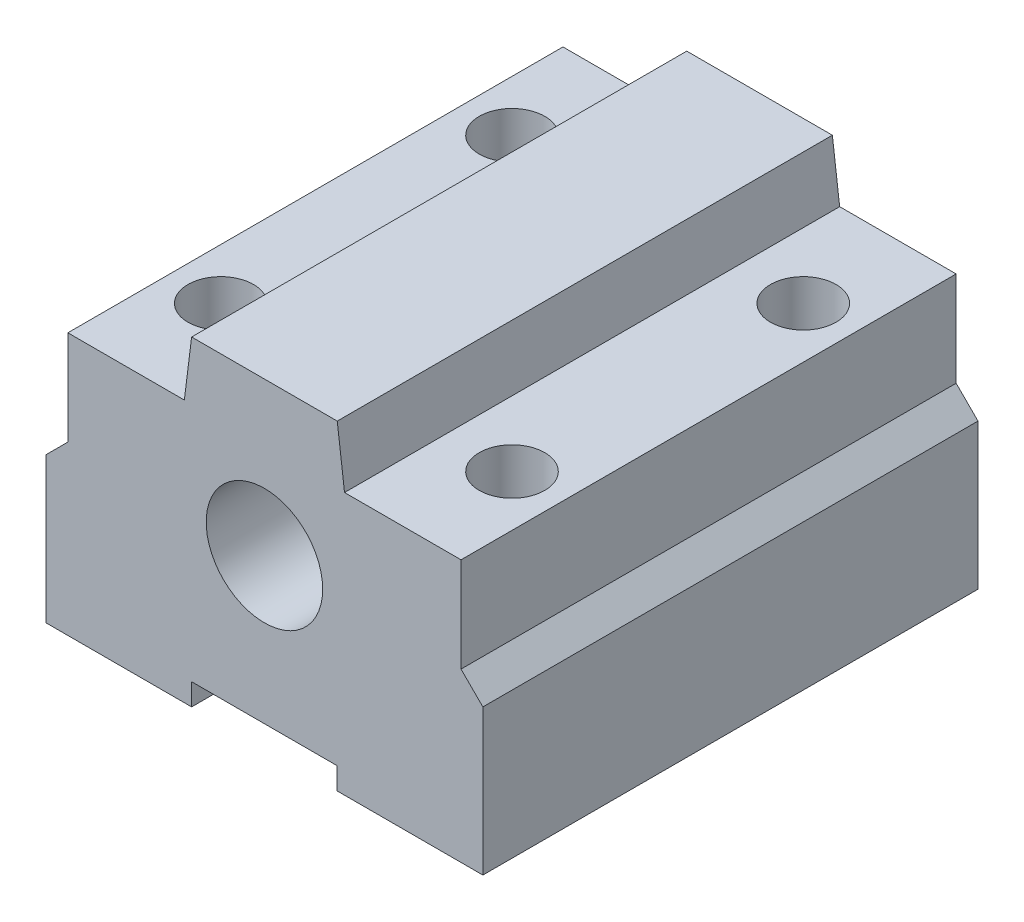
from build123d import *

# Parameters (mm, degrees)
SKETCH1_R           = 4
BOSS_EXTRUDE1_DEPTH = 34
SKETCH2_R           = 2.25
CUT_EXTRUDE1_DEPTH  = 42.291645644


with BuildPart() as part:
    # Sketch1 → Boss-Extrude1 (new body)
    with BuildSketch(Plane.XY):
        Polygon((5, -10), (-5, -10), (-5, -11.5), (-15, -11.5), (-15, -1.5), (-13.5, 0), (-13.5, 6.5), (-5.5, 6.5), (-5, 10.5), (5, 10.5), (5.5, 6.5), (13.5, 6.5), (13.5, 0), (15, -1.5), (15, -11.5), (5, -11.5), align=None)
        Circle(SKETCH1_R, mode=Mode.SUBTRACT)
    extrude(amount=BOSS_EXTRUDE1_DEPTH)

    # Sketch2 → Cut-Extrude1 (cut, through all)
    with BuildSketch(Plane(origin=(0, 6.5, 0), x_dir=(1, 0, 0), z_dir=(0, 1, 0))):
        with Locations(Location((10, -27, 0), (0, 0, 270))):
            Circle(SKETCH2_R)
        with Locations(Location((10, -7, 0), (0, 0, 270))):
            Circle(SKETCH2_R)
    cut_extrude1 = extrude(amount=-CUT_EXTRUDE1_DEPTH, mode=Mode.SUBTRACT)

    # Mirror1: Cut-Extrude1 across plane
    add(cut_extrude1.mirror(Plane(origin=(0, 0, 0), x_dir=(0, 0, 1), z_dir=(1, 0, 0))), mode=Mode.SUBTRACT)


solid = part.part
